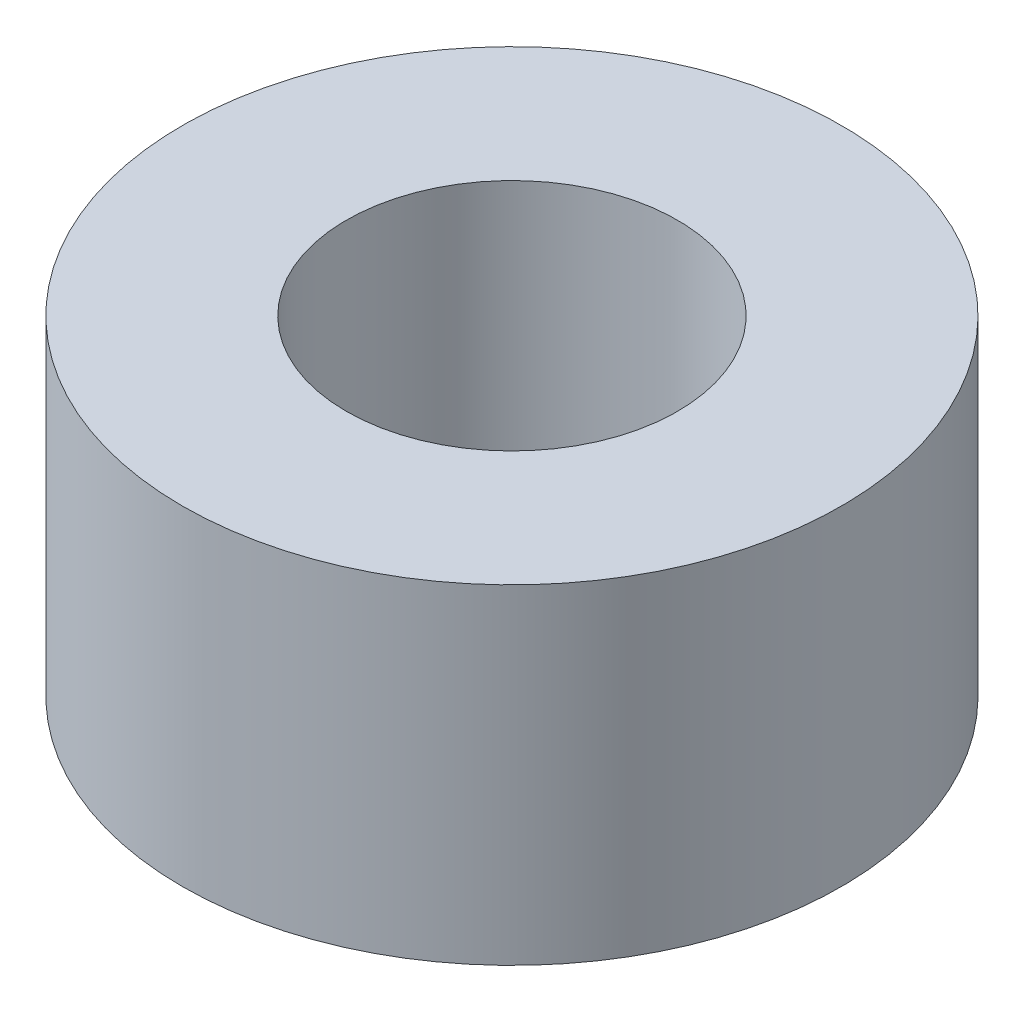
from build123d import *

# Parameters (mm, degrees)
SKETCH1_R           = 10
BOSS_EXTRUDE1_DEPTH = 10
SKETCH2_R           = 5.025
CUT_EXTRUDE1_DEPTH  = 10


with BuildPart() as part:
    # Sketch1 → Boss-Extrude1 (new body)
    with BuildSketch(Plane(origin=(0, 0, 0), x_dir=(1, 0, 0), z_dir=(0, 1, 0))):
        with Locations(Location((0, 0, 0), (0, 0, 270))):
            Circle(SKETCH1_R)
    extrude(amount=BOSS_EXTRUDE1_DEPTH)

    # Sketch2 → Cut-Extrude1 (cut)
    with BuildSketch(Plane(origin=(0, 0, 0), x_dir=(1, 0, 0), z_dir=(0, 1, 0))):
        with Locations(Location((0, 0, 0), (0, 0, 270))):
            Circle(SKETCH2_R)
    extrude(amount=CUT_EXTRUDE1_DEPTH, mode=Mode.SUBTRACT)


solid = part.part
